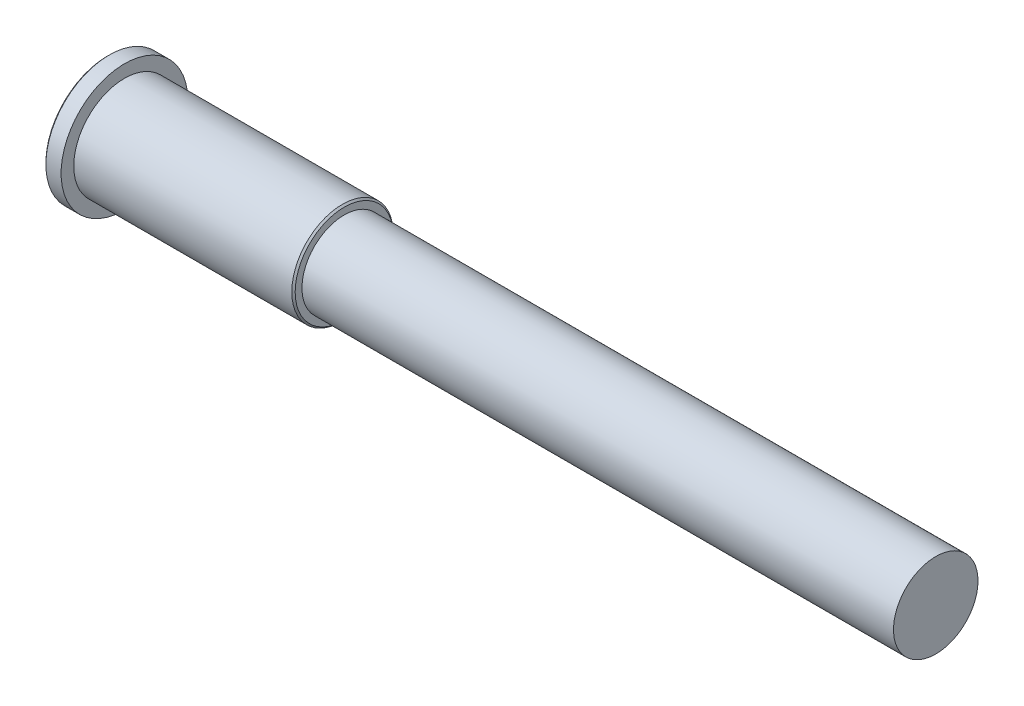
from build123d import *

# Parameters (mm, degrees)
SKETCH1_R           = 7.5
BOSS_EXTRUDE1_DEPTH = 2
SKETCH2_R           = 6
BOSS_EXTRUDE2_DEPTH = 26
SKETCH3_R           = 5
BOSS_EXTRUDE3_DEPTH = 70
CHAMFER1_SIZE       = 0.2
SCALE1_SCALE        = 0.317565217


with BuildPart() as part:
    # Sketch1 → Boss-Extrude1 (new body)
    with BuildSketch(Plane(origin=(0, 0, 0), x_dir=(0, 0, -1), z_dir=(1, 0, 0))):
        Circle(SKETCH1_R)
    extrude(amount=BOSS_EXTRUDE1_DEPTH)

    # Sketch2 → Boss-Extrude2 (add)
    with BuildSketch(Plane(origin=(2, 0, 0), x_dir=(0, 0, -1), z_dir=(1, 0, 0))):
        with Locations(Location((0, 0, 0), (0, 0, 180))):
            Circle(SKETCH2_R)
    extrude(amount=BOSS_EXTRUDE2_DEPTH)

    # Sketch3 → Boss-Extrude3 (add)
    with BuildSketch(Plane(origin=(28, 0, 0), x_dir=(0, 0, -1), z_dir=(1, 0, 0))):
        Circle(SKETCH3_R)
    extrude(amount=BOSS_EXTRUDE3_DEPTH)

    # Chamfer1
    chamfer1_edges = [part.edges().sort_by_distance(p)[0] for p in [
        (0, 0, 7.5),
        (28, 0, -6),
    ]]
    chamfer(chamfer1_edges, length=CHAMFER1_SIZE)


with BuildPart() as part_1:
    # Scale1: scaled about (44.459396685, 0, 0)
    add(part.part.scale(SCALE1_SCALE).moved(Location((30.340638712, 0, 0))))


solid = part_1.part
